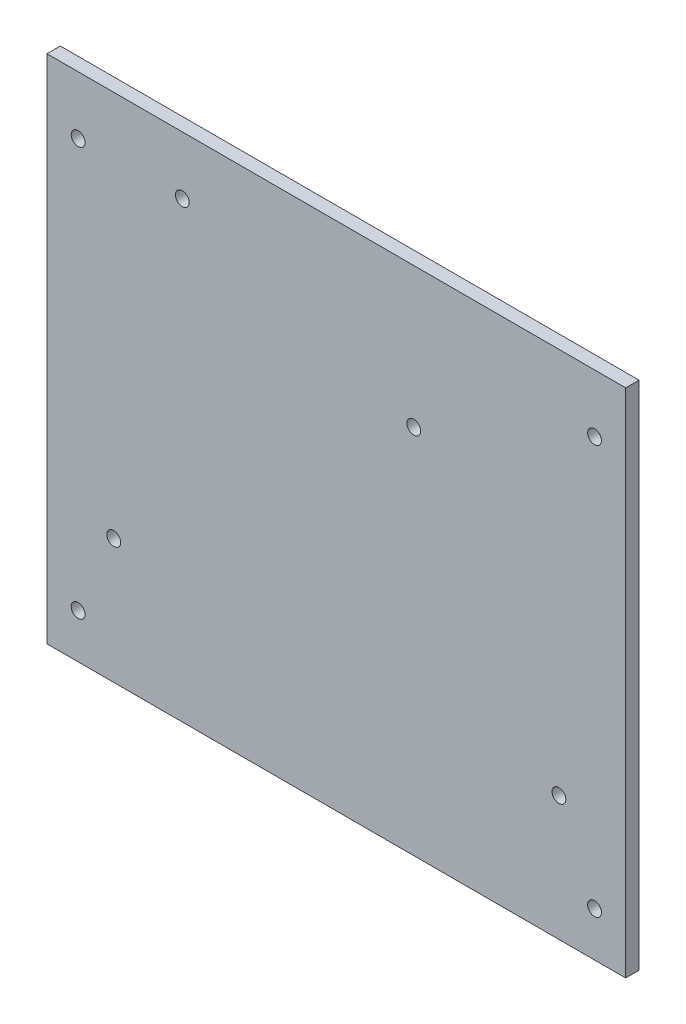
from build123d import *

# Parameters (mm, degrees)
CROQUIS1_W              = 130
CROQUIS1_H              = 114.8
SALIENTE_EXTRUIR1_DEPTH = 3
CROQUIS2_R              = 1.55
CORTAR_EXTRUIR1_DEPTH   = 87.768427438


with BuildPart() as part:
    # Croquis1 → Saliente-Extruir1 (new body)
    with BuildSketch(Plane.XY):
        Rectangle(CROQUIS1_W, CROQUIS1_H)
    extrude(amount=SALIENTE_EXTRUIR1_DEPTH)

    # Croquis2 → Cortar-Extruir1 (cut, through all)
    with BuildSketch(Plane.XY.offset(3)):
        with Locations((-58, -47.4)):
            Circle(CROQUIS2_R)
        with Locations((-58, 44.4)):
            Circle(CROQUIS2_R)
        with Locations((58, 44.4)):
            Circle(CROQUIS2_R)
        with Locations((58, -47.4)):
            Circle(CROQUIS2_R)
        with Locations((-50, -29.4)):
            Circle(CROQUIS2_R)
        with Locations((50, -29.4)):
            Circle(CROQUIS2_R)
        with Locations((-34.6, 44.4)):
            Circle(CROQUIS2_R)
        with Locations((17.4, 25.96)):
            Circle(CROQUIS2_R)
    extrude(amount=-CORTAR_EXTRUIR1_DEPTH, mode=Mode.SUBTRACT)


solid = part.part
